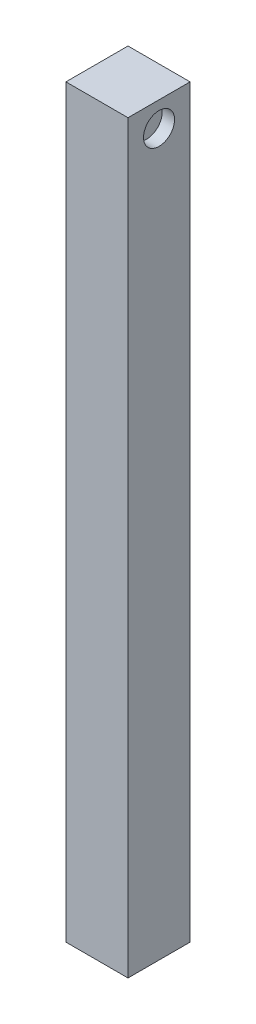
from build123d import *

# Parameters (mm, degrees)
SKETCH1_W           = 100
SKETCH1_H           = 1200
BOSS_EXTRUDE1_DEPTH = 50
SKETCH2_R           = 25
CUT_EXTRUDE1_DEPTH  = 20


with BuildPart() as part:
    # Sketch1 → Boss-Extrude1 (new, symmetric)
    with BuildSketch(Plane(origin=(0, 0, 0), x_dir=(0, 0, -1), z_dir=(1, 0, 0))):
        Rectangle(SKETCH1_W, SKETCH1_H)
    extrude(amount=BOSS_EXTRUDE1_DEPTH, both=True)

    # Sketch2 → Cut-Extrude1 (cut)
    with BuildSketch(Plane(origin=(50, 0, 0), x_dir=(0, 0, -1), z_dir=(1, 0, 0))):
        with Locations((0, 560)):
            Circle(SKETCH2_R)
    extrude(amount=-CUT_EXTRUDE1_DEPTH, mode=Mode.SUBTRACT)


solid = part.part
